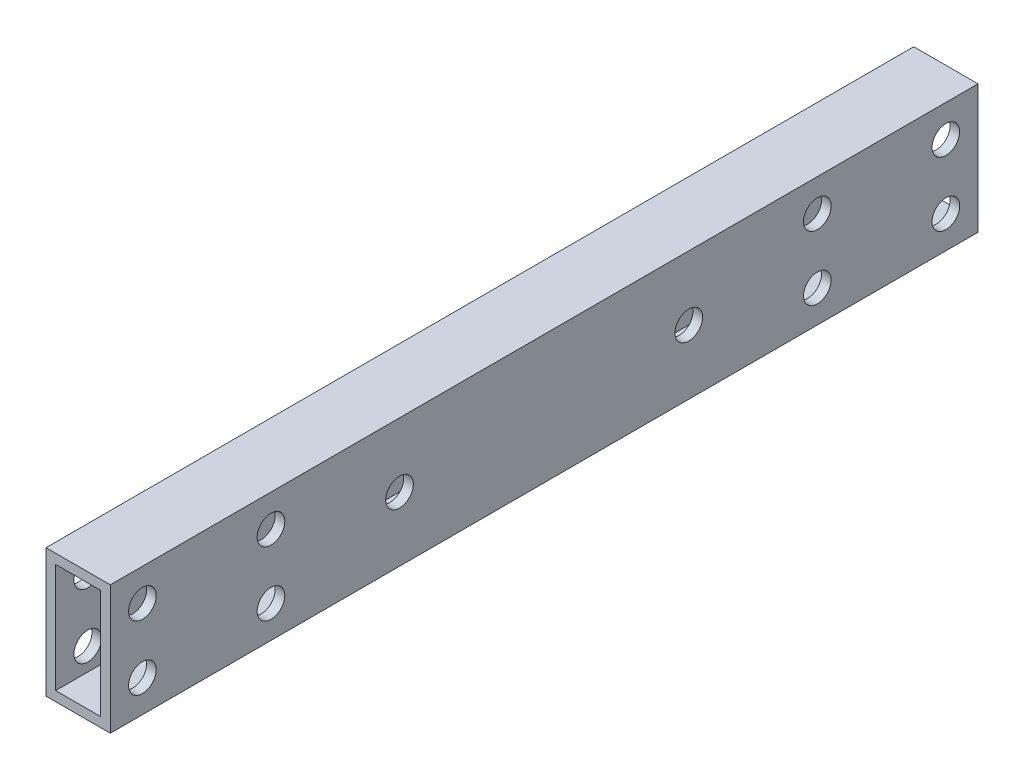
from build123d import *

# Parameters (mm, degrees)
SKETCH_1_W          = 10
SKETCH_1_H          = 20
SKETCH_1_W_2        = 7
SKETCH_1_H_2        = 17
EXTRUDE_1_DEPTH     = 135
CUT_EXTRUDE_2_REACH = 138.839
SKETCH_3_R          = 2.15


with BuildPart() as part:
    # ｽｹｯﾁ1 → 押し出し-薄板1 (new body)
    with BuildSketch(Plane.XY):
        with Locations((5, 10)):
            Rectangle(SKETCH_1_W, SKETCH_1_H)
        with Locations((5, 10)):
            Rectangle(SKETCH_1_W_2, SKETCH_1_H_2, mode=Mode.SUBTRACT)
    extrude(amount=EXTRUDE_1_DEPTH)

    # ｶｯﾄ - 押し出し2: up to this face of the body (flat: up to its plane)
    cut_extrude_2_end = Plane(part.part.faces().sort_by_distance((0, 10, 67.5))[0])
    # ｽｹｯﾁ3 → ｶｯﾄ - 押し出し2 (cut, up to the picked face)
    with BuildSketch(Plane(origin=(10, 0, 0), x_dir=(0, 0, -1), z_dir=(1, 0, 0)), mode=Mode.PRIVATE) as cut_extrude_2_sk1:
        with Locations((-130, 15)):
            Circle(SKETCH_3_R)
    cut_extrude_2_tool1 = split(extrude(cut_extrude_2_sk1.sketch, amount=-CUT_EXTRUDE_2_REACH, mode=Mode.PRIVATE), bisect_by=cut_extrude_2_end, keep=Keep.BOTH, mode=Mode.PRIVATE)
    # ｽｹｯﾁ3 → ｶｯﾄ - 押し出し2 (cut, up to the picked face)
    with BuildSketch(Plane(origin=(10, 0, 0), x_dir=(0, 0, -1), z_dir=(1, 0, 0)), mode=Mode.PRIVATE) as cut_extrude_2_sk2:
        with Locations((-110, 15)):
            Circle(SKETCH_3_R)
    cut_extrude_2_tool2 = split(extrude(cut_extrude_2_sk2.sketch, amount=-CUT_EXTRUDE_2_REACH, mode=Mode.PRIVATE), bisect_by=cut_extrude_2_end, keep=Keep.BOTH, mode=Mode.PRIVATE)
    # ｽｹｯﾁ3 → ｶｯﾄ - 押し出し2 (cut, up to the picked face)
    with BuildSketch(Plane(origin=(10, 0, 0), x_dir=(0, 0, -1), z_dir=(1, 0, 0)), mode=Mode.PRIVATE) as cut_extrude_2_sk3:
        with Locations(Location((-25, 15, 0), (0, 0, 180))):
            Circle(SKETCH_3_R)
    cut_extrude_2_tool3 = split(extrude(cut_extrude_2_sk3.sketch, amount=-CUT_EXTRUDE_2_REACH, mode=Mode.PRIVATE), bisect_by=cut_extrude_2_end, keep=Keep.BOTH, mode=Mode.PRIVATE)
    # ｽｹｯﾁ3 → ｶｯﾄ - 押し出し2 (cut, up to the picked face)
    with BuildSketch(Plane(origin=(10, 0, 0), x_dir=(0, 0, -1), z_dir=(1, 0, 0)), mode=Mode.PRIVATE) as cut_extrude_2_sk4:
        with Locations(Location((-5, 15, 0), (0, 0, 180))):
            Circle(SKETCH_3_R)
    cut_extrude_2_tool4 = split(extrude(cut_extrude_2_sk4.sketch, amount=-CUT_EXTRUDE_2_REACH, mode=Mode.PRIVATE), bisect_by=cut_extrude_2_end, keep=Keep.BOTH, mode=Mode.PRIVATE)
    # ｽｹｯﾁ3 → ｶｯﾄ - 押し出し2 (cut, up to the picked face)
    with BuildSketch(Plane(origin=(10, 0, 0), x_dir=(0, 0, -1), z_dir=(1, 0, 0)), mode=Mode.PRIVATE) as cut_extrude_2_sk5:
        with Locations((-5, 5)):
            Circle(SKETCH_3_R)
    cut_extrude_2_tool5 = split(extrude(cut_extrude_2_sk5.sketch, amount=-CUT_EXTRUDE_2_REACH, mode=Mode.PRIVATE), bisect_by=cut_extrude_2_end, keep=Keep.BOTH, mode=Mode.PRIVATE)
    # ｽｹｯﾁ3 → ｶｯﾄ - 押し出し2 (cut, up to the picked face)
    with BuildSketch(Plane(origin=(10, 0, 0), x_dir=(0, 0, -1), z_dir=(1, 0, 0)), mode=Mode.PRIVATE) as cut_extrude_2_sk6:
        with Locations((-25, 5)):
            Circle(SKETCH_3_R)
    cut_extrude_2_tool6 = split(extrude(cut_extrude_2_sk6.sketch, amount=-CUT_EXTRUDE_2_REACH, mode=Mode.PRIVATE), bisect_by=cut_extrude_2_end, keep=Keep.BOTH, mode=Mode.PRIVATE)
    # ｽｹｯﾁ3 → ｶｯﾄ - 押し出し2 (cut, up to the picked face)
    with BuildSketch(Plane(origin=(10, 0, 0), x_dir=(0, 0, -1), z_dir=(1, 0, 0)), mode=Mode.PRIVATE) as cut_extrude_2_sk7:
        with Locations(Location((-110, 5, 0), (0, 0, 180))):
            Circle(SKETCH_3_R)
    cut_extrude_2_tool7 = split(extrude(cut_extrude_2_sk7.sketch, amount=-CUT_EXTRUDE_2_REACH, mode=Mode.PRIVATE), bisect_by=cut_extrude_2_end, keep=Keep.BOTH, mode=Mode.PRIVATE)
    # ｽｹｯﾁ3 → ｶｯﾄ - 押し出し2 (cut, up to the picked face)
    with BuildSketch(Plane(origin=(10, 0, 0), x_dir=(0, 0, -1), z_dir=(1, 0, 0)), mode=Mode.PRIVATE) as cut_extrude_2_sk8:
        with Locations(Location((-130, 5, 0), (0, 0, 180))):
            Circle(SKETCH_3_R)
    cut_extrude_2_tool8 = split(extrude(cut_extrude_2_sk8.sketch, amount=-CUT_EXTRUDE_2_REACH, mode=Mode.PRIVATE), bisect_by=cut_extrude_2_end, keep=Keep.BOTH, mode=Mode.PRIVATE)
    # ｽｹｯﾁ3 → ｶｯﾄ - 押し出し2 (cut, up to the picked face)
    with BuildSketch(Plane(origin=(10, 0, 0), x_dir=(0, 0, -1), z_dir=(1, 0, 0)), mode=Mode.PRIVATE) as cut_extrude_2_sk9:
        with Locations((-45, 10)):
            Circle(SKETCH_3_R)
    cut_extrude_2_tool9 = split(extrude(cut_extrude_2_sk9.sketch, amount=-CUT_EXTRUDE_2_REACH, mode=Mode.PRIVATE), bisect_by=cut_extrude_2_end, keep=Keep.BOTH, mode=Mode.PRIVATE)
    # ｽｹｯﾁ3 → ｶｯﾄ - 押し出し2 (cut, up to the picked face)
    with BuildSketch(Plane(origin=(10, 0, 0), x_dir=(0, 0, -1), z_dir=(1, 0, 0)), mode=Mode.PRIVATE) as cut_extrude_2_sk10:
        with Locations(Location((-90, 10, 0), (0, 0, 180))):
            Circle(SKETCH_3_R)
    cut_extrude_2_tool10 = split(extrude(cut_extrude_2_sk10.sketch, amount=-CUT_EXTRUDE_2_REACH, mode=Mode.PRIVATE), bisect_by=cut_extrude_2_end, keep=Keep.BOTH, mode=Mode.PRIVATE)
    add(cut_extrude_2_tool1.solids().sort_by(Axis((10, 15, 130), (-1, 0, 0)))[0], mode=Mode.SUBTRACT)
    add(cut_extrude_2_tool2.solids().sort_by(Axis((10, 15, 110), (-1, 0, 0)))[0], mode=Mode.SUBTRACT)
    add(cut_extrude_2_tool3.solids().sort_by(Axis((10, 15, 25), (-1, 0, 0)))[0], mode=Mode.SUBTRACT)
    add(cut_extrude_2_tool4.solids().sort_by(Axis((10, 15, 5), (-1, 0, 0)))[0], mode=Mode.SUBTRACT)
    add(cut_extrude_2_tool5.solids().sort_by(Axis((10, 5, 5), (-1, 0, 0)))[0], mode=Mode.SUBTRACT)
    add(cut_extrude_2_tool6.solids().sort_by(Axis((10, 5, 25), (-1, 0, 0)))[0], mode=Mode.SUBTRACT)
    add(cut_extrude_2_tool7.solids().sort_by(Axis((10, 5, 110), (-1, 0, 0)))[0], mode=Mode.SUBTRACT)
    add(cut_extrude_2_tool8.solids().sort_by(Axis((10, 5, 130), (-1, 0, 0)))[0], mode=Mode.SUBTRACT)
    add(cut_extrude_2_tool9.solids().sort_by(Axis((10, 10, 45), (-1, 0, 0)))[0], mode=Mode.SUBTRACT)
    add(cut_extrude_2_tool10.solids().sort_by(Axis((10, 10, 90), (-1, 0, 0)))[0], mode=Mode.SUBTRACT)


solid = part.part
